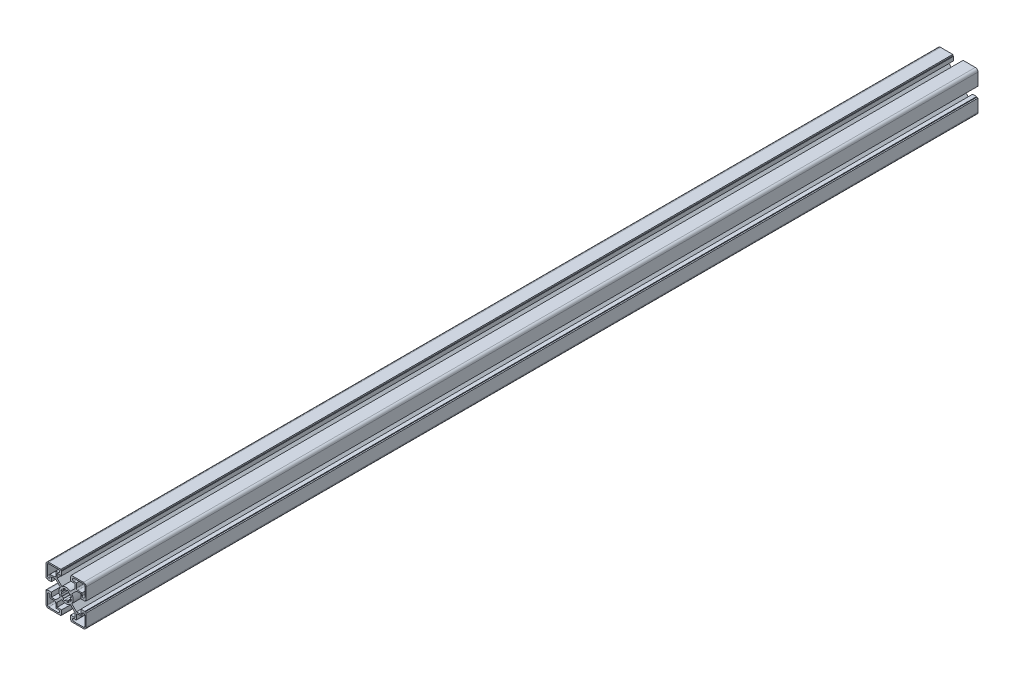
from build123d import *

# Parameters (mm, degrees)
BOSS_EXTRUDE1_DEPTH = 500


with BuildPart() as part:
    # Sketch1 → Boss-Extrude1 (new, symmetric)
    with BuildSketch(Plane.XY):
        with BuildLine():
            Line((-19.5072, 22.5044), (-5.7912, 22.5044))
            Line((-5.7912, 22.5044), (-5.7912, 21.0058))
            Line((-5.7912, 21.0058), (-5.0038, 21.0058))
            Line((-5.0038, 21.0058), (-5.0038, 16.51))
            Line((-5.0038, 16.51), (-10.0457, 16.51))
            Line((-10.0457, 16.51), (-10.0457, 11.680106614))
            Line((-10.0457, 11.680106614), (-4.781026704, 6.415433318))
            ThreePointArc((-4.781026704, 6.415433318), (0, 8.001), (4.781026704, 6.415433318))
            Line((4.781026704, 6.415433318), (10.0457, 11.680106614))
            Line((10.0457, 11.680106614), (10.0457, 16.51))
            Line((10.0457, 16.51), (5.0038, 16.51))
            Line((5.0038, 16.51), (5.0038, 21.0058))
            Line((5.0038, 21.0058), (5.7912, 21.0058))
            Line((5.7912, 21.0058), (5.7912, 22.5044))
            Line((5.7912, 22.5044), (19.5072, 22.5044))
            ThreePointArc((19.5072, 22.5044), (21.626540445, 21.626540445), (22.5044, 19.5072))
            Line((22.5044, 19.5072), (22.5044, 5.7912))
            Line((22.5044, 5.7912), (21.0058, 5.7912))
            Line((21.0058, 5.7912), (21.0058, 5.0038))
            Line((21.0058, 5.0038), (16.51, 5.0038))
            Line((16.51, 5.0038), (16.51, 10.0457))
            Line((16.51, 10.0457), (11.680106614, 10.0457))
            Line((11.680106614, 10.0457), (6.415433318, 4.781026704))
            ThreePointArc((6.415433318, 4.781026704), (8.001, 0), (6.415433318, -4.781026704))
            Line((6.415433318, -4.781026704), (11.680106614, -10.0457))
            Line((11.680106614, -10.0457), (16.51, -10.0457))
            Line((16.51, -10.0457), (16.51, -5.0038))
            Line((16.51, -5.0038), (21.0058, -5.0038))
            Line((21.0058, -5.0038), (21.0058, -5.7912))
            Line((21.0058, -5.7912), (22.5044, -5.7912))
            Line((22.5044, -5.7912), (22.5044, -19.5072))
            ThreePointArc((22.5044, -19.5072), (21.626540445, -21.626540445), (19.5072, -22.5044))
            Line((19.5072, -22.5044), (5.7912, -22.5044))
            Line((5.7912, -22.5044), (5.7912, -21.0058))
            Line((5.7912, -21.0058), (5.0038, -21.0058))
            Line((5.0038, -21.0058), (5.0038, -16.51))
            Line((5.0038, -16.51), (10.0457, -16.51))
            Line((10.0457, -16.51), (10.0457, -11.680106614))
            Line((10.0457, -11.680106614), (4.781026704, -6.415433318))
            ThreePointArc((4.781026704, -6.415433318), (0, -8.001), (-4.781026704, -6.415433318))
            Line((-4.781026704, -6.415433318), (-10.0457, -11.680106614))
            Line((-10.0457, -11.680106614), (-10.0457, -16.51))
            Line((-10.0457, -16.51), (-5.0038, -16.51))
            Line((-5.0038, -16.51), (-5.0038, -21.0058))
            Line((-5.0038, -21.0058), (-5.7912, -21.0058))
            Line((-5.7912, -21.0058), (-5.7912, -22.5044))
            Line((-5.7912, -22.5044), (-19.5072, -22.5044))
            ThreePointArc((-19.5072, -22.5044), (-21.626540445, -21.626540445), (-22.5044, -19.5072))
            Line((-22.5044, -19.5072), (-22.5044, -5.7912))
            Line((-22.5044, -5.7912), (-21.0058, -5.7912))
            Line((-21.0058, -5.7912), (-21.0058, -5.0038))
            Line((-21.0058, -5.0038), (-16.51, -5.0038))
            Line((-16.51, -5.0038), (-16.51, -10.0457))
            Line((-16.51, -10.0457), (-11.680106614, -10.0457))
            Line((-11.680106614, -10.0457), (-6.415433318, -4.781026704))
            ThreePointArc((-6.415433318, -4.781026704), (-8.001, 0), (-6.415433318, 4.781026704))
            Line((-6.415433318, 4.781026704), (-11.680106614, 10.0457))
            Line((-11.680106614, 10.0457), (-16.51, 10.0457))
            Line((-16.51, 10.0457), (-16.51, 5.0038))
            Line((-16.51, 5.0038), (-21.0058, 5.0038))
            Line((-21.0058, 5.0038), (-21.0058, 5.7912))
            Line((-21.0058, 5.7912), (-22.5044, 5.7912))
            Line((-22.5044, 5.7912), (-22.5044, 19.5072))
            ThreePointArc((-22.5044, 19.5072), (-21.626540445, 21.626540445), (-19.5072, 22.5044))
        make_face()
        with BuildLine():
            Line((-18.0086, 11.5443), (-13.0429, 11.5443))
            ThreePointArc((-13.0429, 11.5443), (-11.983229778, 11.983229778), (-11.5443, 13.0429))
            Line((-11.5443, 13.0429), (-11.5443, 18.0086))
            Line((-11.5443, 18.0086), (-8.7884, 18.0086))
            ThreePointArc((-8.7884, 18.0086), (-7.2898, 19.5072), (-8.7884, 21.0058))
            Line((-8.7884, 21.0058), (-19.5072, 21.0058))
            ThreePointArc((-19.5072, 21.0058), (-20.566870222, 20.566870222), (-21.0058, 19.5072))
            Line((-21.0058, 19.5072), (-21.0058, 8.7884))
            ThreePointArc((-21.0058, 8.7884), (-19.5072, 7.2898), (-18.0086, 8.7884))
            Line((-18.0086, 8.7884), (-18.0086, 11.5443))
        make_face(mode=Mode.SUBTRACT)
        with BuildLine():
            Line((1.189270603, 5.978867069), (0.976192953, 4.907653386))
            ThreePointArc((0.976192953, 4.907653386), (0, 5.0038), (-0.976192953, 4.907653386))
            Line((-0.976192953, 4.907653386), (-1.189270603, 5.978867069))
            ThreePointArc((-1.189270603, 5.978867069), (-2.332838204, 5.63196963), (-3.38675614, 5.068638757))
            Line((-3.38675614, 5.068638757), (-2.779962332, 4.160507646))
            ThreePointArc((-2.779962332, 4.160507646), (-3.538220912, 3.538220912), (-4.160507646, 2.779962332))
            Line((-4.160507646, 2.779962332), (-5.068638757, 3.38675614))
            ThreePointArc((-5.068638757, 3.38675614), (-5.63196963, 2.332838204), (-5.978867069, 1.189270603))
            Line((-5.978867069, 1.189270603), (-4.907653386, 0.976192953))
            ThreePointArc((-4.907653386, 0.976192953), (-5.0038, 0), (-4.907653386, -0.976192953))
            Line((-4.907653386, -0.976192953), (-5.978867069, -1.189270603))
            ThreePointArc((-5.978867069, -1.189270603), (-5.63196963, -2.332838204), (-5.068638757, -3.38675614))
            Line((-5.068638757, -3.38675614), (-4.160507646, -2.779962332))
            ThreePointArc((-4.160507646, -2.779962332), (-3.538220912, -3.538220912), (-2.779962332, -4.160507646))
            Line((-2.779962332, -4.160507646), (-3.38675614, -5.068638757))
            ThreePointArc((-3.38675614, -5.068638757), (-2.332838204, -5.63196963), (-1.189270603, -5.978867069))
            Line((-1.189270603, -5.978867069), (-0.976192953, -4.907653386))
            ThreePointArc((-0.976192953, -4.907653386), (0, -5.0038), (0.976192953, -4.907653386))
            Line((0.976192953, -4.907653386), (1.189270603, -5.978867069))
            ThreePointArc((1.189270603, -5.978867069), (2.332838204, -5.63196963), (3.38675614, -5.068638757))
            Line((3.38675614, -5.068638757), (2.779962332, -4.160507646))
            ThreePointArc((2.779962332, -4.160507646), (3.538220912, -3.538220912), (4.160507646, -2.779962332))
            Line((4.160507646, -2.779962332), (5.068638757, -3.38675614))
            ThreePointArc((5.068638757, -3.38675614), (5.63196963, -2.332838204), (5.978867069, -1.189270603))
            Line((5.978867069, -1.189270603), (4.907653386, -0.976192953))
            ThreePointArc((4.907653386, -0.976192953), (5.0038, 0), (4.907653386, 0.976192953))
            Line((4.907653386, 0.976192953), (5.978867069, 1.189270603))
            ThreePointArc((5.978867069, 1.189270603), (5.63196963, 2.332838204), (5.068638757, 3.38675614))
            Line((5.068638757, 3.38675614), (4.160507646, 2.779962332))
            ThreePointArc((4.160507646, 2.779962332), (3.538220912, 3.538220912), (2.779962332, 4.160507646))
            Line((2.779962332, 4.160507646), (3.38675614, 5.068638757))
            ThreePointArc((3.38675614, 5.068638757), (2.332838204, 5.63196963), (1.189270603, 5.978867069))
        make_face(mode=Mode.SUBTRACT)
        with BuildLine():
            Line((11.5443, 18.0086), (8.7884, 18.0086))
            ThreePointArc((8.7884, 18.0086), (7.2898, 19.5072), (8.7884, 21.0058))
            Line((8.7884, 21.0058), (19.5072, 21.0058))
            ThreePointArc((19.5072, 21.0058), (20.566870222, 20.566870222), (21.0058, 19.5072))
            Line((21.0058, 19.5072), (21.0058, 8.7884))
            ThreePointArc((21.0058, 8.7884), (19.5072, 7.2898), (18.0086, 8.7884))
            Line((18.0086, 8.7884), (18.0086, 11.5443))
            Line((18.0086, 11.5443), (13.0429, 11.5443))
            ThreePointArc((13.0429, 11.5443), (11.983229778, 11.983229778), (11.5443, 13.0429))
            Line((11.5443, 13.0429), (11.5443, 18.0086))
        make_face(mode=Mode.SUBTRACT)
        with BuildLine():
            Line((18.0086, -11.5443), (13.0429, -11.5443))
            ThreePointArc((13.0429, -11.5443), (11.983229778, -11.983229778), (11.5443, -13.0429))
            Line((11.5443, -13.0429), (11.5443, -18.0086))
            Line((11.5443, -18.0086), (8.7884, -18.0086))
            ThreePointArc((8.7884, -18.0086), (7.2898, -19.5072), (8.7884, -21.0058))
            Line((8.7884, -21.0058), (19.5072, -21.0058))
            ThreePointArc((19.5072, -21.0058), (20.566870222, -20.566870222), (21.0058, -19.5072))
            Line((21.0058, -19.5072), (21.0058, -8.7884))
            ThreePointArc((21.0058, -8.7884), (19.5072, -7.2898), (18.0086, -8.7884))
            Line((18.0086, -8.7884), (18.0086, -11.5443))
        make_face(mode=Mode.SUBTRACT)
        with BuildLine():
            Line((-11.5443, -18.0086), (-8.7884, -18.0086))
            ThreePointArc((-8.7884, -18.0086), (-7.2898, -19.5072), (-8.7884, -21.0058))
            Line((-8.7884, -21.0058), (-19.5072, -21.0058))
            ThreePointArc((-19.5072, -21.0058), (-20.566870222, -20.566870222), (-21.0058, -19.5072))
            Line((-21.0058, -19.5072), (-21.0058, -8.7884))
            ThreePointArc((-21.0058, -8.7884), (-19.5072, -7.2898), (-18.0086, -8.7884))
            Line((-18.0086, -8.7884), (-18.0086, -11.5443))
            Line((-18.0086, -11.5443), (-13.0429, -11.5443))
            ThreePointArc((-13.0429, -11.5443), (-11.983229778, -11.983229778), (-11.5443, -13.0429))
            Line((-11.5443, -13.0429), (-11.5443, -18.0086))
        make_face(mode=Mode.SUBTRACT)
    extrude(amount=BOSS_EXTRUDE1_DEPTH, both=True)


solid = part.part
